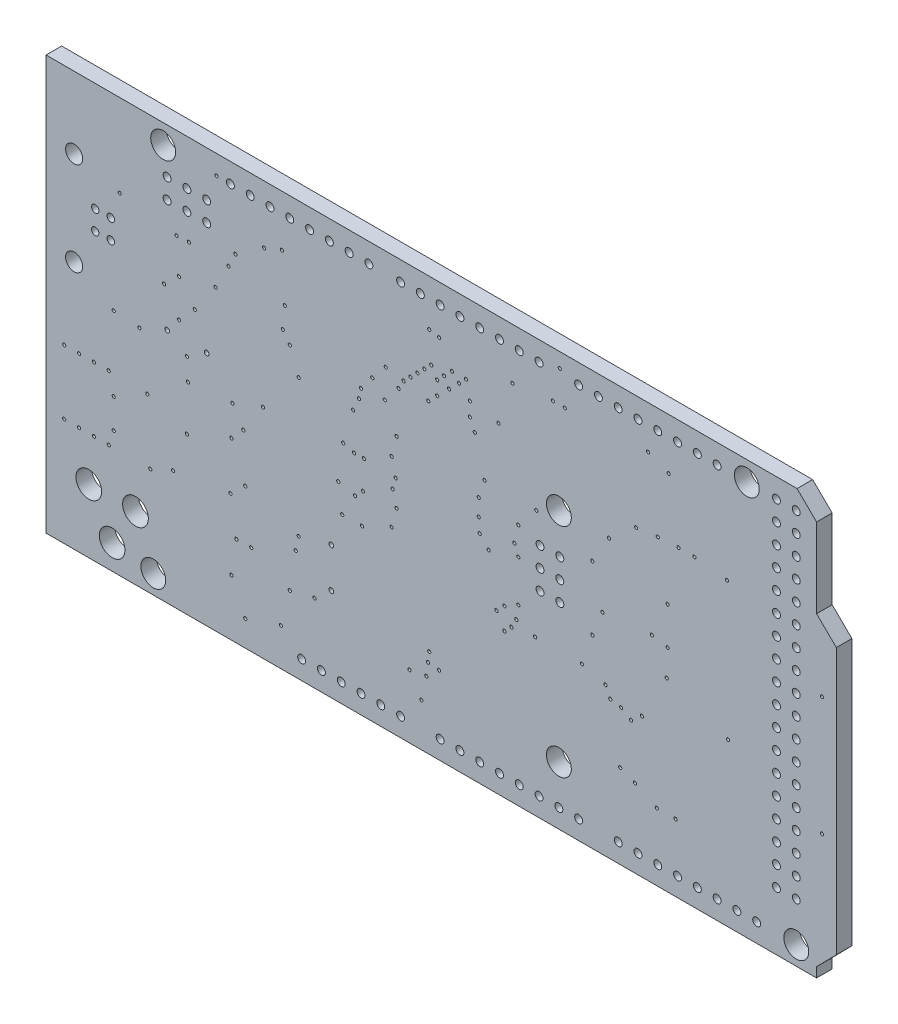
from build123d import *

# Parameters (mm, degrees)
SKETCH1_W           = 134.5210924
SKETCH1_H           = 72.181339
SKETCH1_R           = 1.5999968
SKETCH1_R_2         = 0.508
SKETCH1_R_3         = 0.3048
SKETCH1_R_4         = 1.651
SKETCH1_R_5         = 0.4750054
SKETCH1_R_6         = 1.0999978
SKETCH1_R_7         = 0.2032
BOSS_EXTRUDE1_DEPTH = 2
SKETCH2_W           = 162.13268737
SKETCH2_H           = 90.144306229
CUT_EXTRUDE1_DEPTH  = 10


with BuildPart() as part:
    # Sketch1 → Boss-Extrude1 (new body)
    with BuildSketch(Plane(origin=(0, 0, 0), x_dir=(-1, 0, 0), z_dir=(0, 0, -1))):
        with Locations((-40.0783056, -28.4573305)):
            Rectangle(SKETCH1_W, SKETCH1_H)
        with Locations(Location((-81.88, -46.26, 0), (0, 0, 180))):
            Circle(SKETCH1_R, mode=Mode.SUBTRACT)
        with Locations(Location((-0.6, 2, 0), (0, 0, 180))):
            Circle(SKETCH1_R, mode=Mode.SUBTRACT)
        with Locations(Location((-75.53, 2, 0), (0, 0, 180))):
            Circle(SKETCH1_R, mode=Mode.SUBTRACT)
        with Locations(Location((0.67, -46.26, 0), (0, 0, 180))):
            Circle(SKETCH1_R, mode=Mode.SUBTRACT)
        with Locations(Location((-51.4, -13.24, 0), (0, 0, 180))):
            Circle(SKETCH1_R, mode=Mode.SUBTRACT)
        with Locations(Location((-51.4, -41.18, 0), (0, 0, 180))):
            Circle(SKETCH1_R, mode=Mode.SUBTRACT)
        with Locations(Location((-59.02, -46.26, 0), (0, 0, 180))):
            Circle(SKETCH1_R_2, mode=Mode.SUBTRACT)
        with Locations(Location((-61.56, -46.26, 0), (0, 0, 180))):
            Circle(SKETCH1_R_2, mode=Mode.SUBTRACT)
        with Locations(Location((-64.1, -46.26, 0), (0, 0, 180))):
            Circle(SKETCH1_R_2, mode=Mode.SUBTRACT)
        with Locations(Location((-66.64, -46.26, 0), (0, 0, 180))):
            Circle(SKETCH1_R_2, mode=Mode.SUBTRACT)
        with Locations(Location((-69.18, -46.26, 0), (0, 0, 180))):
            Circle(SKETCH1_R_2, mode=Mode.SUBTRACT)
        with Locations(Location((-71.72, -46.26, 0), (0, 0, 180))):
            Circle(SKETCH1_R_2, mode=Mode.SUBTRACT)
        with Locations(Location((-74.26, -46.26, 0), (0, 0, 180))):
            Circle(SKETCH1_R_2, mode=Mode.SUBTRACT)
        with Locations(Location((-76.8, -46.26, 0), (0, 0, 180))):
            Circle(SKETCH1_R_2, mode=Mode.SUBTRACT)
        with Locations(Location((-36.16, -46.26, 0), (0, 0, 180))):
            Circle(SKETCH1_R_2, mode=Mode.SUBTRACT)
        with Locations(Location((-38.7, -46.26, 0), (0, 0, 180))):
            Circle(SKETCH1_R_2, mode=Mode.SUBTRACT)
        with Locations(Location((-41.24, -46.26, 0), (0, 0, 180))):
            Circle(SKETCH1_R_2, mode=Mode.SUBTRACT)
        with Locations(Location((-43.78, -46.26, 0), (0, 0, 180))):
            Circle(SKETCH1_R_2, mode=Mode.SUBTRACT)
        with Locations(Location((-46.32, -46.26, 0), (0, 0, 180))):
            Circle(SKETCH1_R_2, mode=Mode.SUBTRACT)
        with Locations(Location((-48.86, -46.26, 0), (0, 0, 180))):
            Circle(SKETCH1_R_2, mode=Mode.SUBTRACT)
        with Locations(Location((-51.4, -46.26, 0), (0, 0, 180))):
            Circle(SKETCH1_R_2, mode=Mode.SUBTRACT)
        with Locations(Location((-53.94, -46.26, 0), (0, 0, 180))):
            Circle(SKETCH1_R_2, mode=Mode.SUBTRACT)
        with Locations(Location((-71.72, 2, 0), (0, 0, 180))):
            Circle(SKETCH1_R_2, mode=Mode.SUBTRACT)
        with Locations(Location((-69.18, 2, 0), (0, 0, 180))):
            Circle(SKETCH1_R_2, mode=Mode.SUBTRACT)
        with Locations(Location((-66.64, 2, 0), (0, 0, 180))):
            Circle(SKETCH1_R_2, mode=Mode.SUBTRACT)
        with Locations(Location((-64.1, 2, 0), (0, 0, 180))):
            Circle(SKETCH1_R_2, mode=Mode.SUBTRACT)
        with Locations(Location((-61.56, 2, 0), (0, 0, 180))):
            Circle(SKETCH1_R_2, mode=Mode.SUBTRACT)
        with Locations(Location((-59.02, 2, 0), (0, 0, 180))):
            Circle(SKETCH1_R_2, mode=Mode.SUBTRACT)
        with Locations(Location((-56.48, 2, 0), (0, 0, 180))):
            Circle(SKETCH1_R_2, mode=Mode.SUBTRACT)
        with Locations(Location((-53.94, 2, 0), (0, 0, 180))):
            Circle(SKETCH1_R_2, mode=Mode.SUBTRACT)
        with Locations(Location((-48.987, -18.32, 0), (0, 0, 180))):
            Circle(SKETCH1_R_2, mode=Mode.SUBTRACT)
        with Locations(Location((-51.527, -18.32, 0), (0, 0, 180))):
            Circle(SKETCH1_R_2, mode=Mode.SUBTRACT)
        with Locations(Location((-48.987, -20.86, 0), (0, 0, 180))):
            Circle(SKETCH1_R_2, mode=Mode.SUBTRACT)
        with Locations(Location((-51.527, -20.86, 0), (0, 0, 180))):
            Circle(SKETCH1_R_2, mode=Mode.SUBTRACT)
        with Locations(Location((-48.987, -23.4, 0), (0, 0, 180))):
            Circle(SKETCH1_R_2, mode=Mode.SUBTRACT)
        with Locations(Location((-51.527, -23.4, 0), (0, 0, 180))):
            Circle(SKETCH1_R_2, mode=Mode.SUBTRACT)
        with Locations(Location((-6.188, -1.302, 0), (0, 0, 180))):
            Circle(SKETCH1_R_2, mode=Mode.SUBTRACT)
        with Locations(Location((-6.188, -3.842, 0), (0, 0, 180))):
            Circle(SKETCH1_R_2, mode=Mode.SUBTRACT)
        with Locations(Location((-3.648, -1.302, 0), (0, 0, 180))):
            Circle(SKETCH1_R_2, mode=Mode.SUBTRACT)
        with Locations(Location((-3.648, -3.842, 0), (0, 0, 180))):
            Circle(SKETCH1_R_2, mode=Mode.SUBTRACT)
        with Locations(Location((-1.108, -1.302, 0), (0, 0, 180))):
            Circle(SKETCH1_R_2, mode=Mode.SUBTRACT)
        with Locations(Location((-1.108, -3.842, 0), (0, 0, 180))):
            Circle(SKETCH1_R_2, mode=Mode.SUBTRACT)
        with Locations(Location((-79.34, 2, 0), (0, 0, 180))):
            Circle(SKETCH1_R_2, mode=Mode.SUBTRACT)
        with Locations(Location((-81.88, 2, 0), (0, 0, 180))):
            Circle(SKETCH1_R_2, mode=Mode.SUBTRACT)
        with Locations(Location((-79.34, -41.18, 0), (0, 0, 180))):
            Circle(SKETCH1_R_2, mode=Mode.SUBTRACT)
        with Locations(Location((-81.88, -41.18, 0), (0, 0, 180))):
            Circle(SKETCH1_R_2, mode=Mode.SUBTRACT)
        with Locations(Location((-18.38, -46.26, 0), (0, 0, 180))):
            Circle(SKETCH1_R_2, mode=Mode.SUBTRACT)
        with Locations(Location((-20.92, -46.26, 0), (0, 0, 180))):
            Circle(SKETCH1_R_2, mode=Mode.SUBTRACT)
        with Locations(Location((-23.46, -46.26, 0), (0, 0, 180))):
            Circle(SKETCH1_R_2, mode=Mode.SUBTRACT)
        with Locations(Location((-26, -46.26, 0), (0, 0, 180))):
            Circle(SKETCH1_R_2, mode=Mode.SUBTRACT)
        with Locations(Location((-28.54, -46.26, 0), (0, 0, 180))):
            Circle(SKETCH1_R_2, mode=Mode.SUBTRACT)
        with Locations(Location((-31.08, -46.26, 0), (0, 0, 180))):
            Circle(SKETCH1_R_2, mode=Mode.SUBTRACT)
        with Locations(Location((-27.016, 2, 0), (0, 0, 180))):
            Circle(SKETCH1_R_2, mode=Mode.SUBTRACT)
        with Locations(Location((-24.476, 2, 0), (0, 0, 180))):
            Circle(SKETCH1_R_2, mode=Mode.SUBTRACT)
        with Locations(Location((-21.936, 2, 0), (0, 0, 180))):
            Circle(SKETCH1_R_2, mode=Mode.SUBTRACT)
        with Locations(Location((-19.396, 2, 0), (0, 0, 180))):
            Circle(SKETCH1_R_2, mode=Mode.SUBTRACT)
        with Locations(Location((-16.856, 2, 0), (0, 0, 180))):
            Circle(SKETCH1_R_2, mode=Mode.SUBTRACT)
        with Locations(Location((-14.316, 2, 0), (0, 0, 180))):
            Circle(SKETCH1_R_2, mode=Mode.SUBTRACT)
        with Locations(Location((-11.776, 2, 0), (0, 0, 180))):
            Circle(SKETCH1_R_2, mode=Mode.SUBTRACT)
        with Locations(Location((-9.236, 2, 0), (0, 0, 180))):
            Circle(SKETCH1_R_2, mode=Mode.SUBTRACT)
        with Locations(Location((-48.86, 2, 0), (0, 0, 180))):
            Circle(SKETCH1_R_2, mode=Mode.SUBTRACT)
        with Locations(Location((-46.32, 2, 0), (0, 0, 180))):
            Circle(SKETCH1_R_2, mode=Mode.SUBTRACT)
        with Locations(Location((-43.78, 2, 0), (0, 0, 180))):
            Circle(SKETCH1_R_2, mode=Mode.SUBTRACT)
        with Locations(Location((-41.24, 2, 0), (0, 0, 180))):
            Circle(SKETCH1_R_2, mode=Mode.SUBTRACT)
        with Locations(Location((-38.7, 2, 0), (0, 0, 180))):
            Circle(SKETCH1_R_2, mode=Mode.SUBTRACT)
        with Locations(Location((-36.16, 2, 0), (0, 0, 180))):
            Circle(SKETCH1_R_2, mode=Mode.SUBTRACT)
        with Locations(Location((-33.62, 2, 0), (0, 0, 180))):
            Circle(SKETCH1_R_2, mode=Mode.SUBTRACT)
        with Locations(Location((-31.08, 2, 0), (0, 0, 180))):
            Circle(SKETCH1_R_2, mode=Mode.SUBTRACT)
        with Locations(Location((-6.188, -18.32, 0), (0, 0, 180))):
            Circle(SKETCH1_R_3, mode=Mode.SUBTRACT)
        with Locations(Location((-1.108, -18.32, 0), (0, 0, 180))):
            Circle(SKETCH1_R_3, mode=Mode.SUBTRACT)
        with Locations(Location((-22.19, -31.655, 0), (0, 0, 180))):
            Circle(SKETCH1_R_3, mode=Mode.SUBTRACT)
        with Locations(Location((-22.19, -36.735, 0), (0, 0, 180))):
            Circle(SKETCH1_R_3, mode=Mode.SUBTRACT)
        with Locations(Location((5.9532, -45.498, 0), (0, 0, 180))):
            Circle(SKETCH1_R_4, mode=Mode.SUBTRACT)
        with Locations(Location((2.956, -40.4942, 0), (0, 0, 180))):
            Circle(SKETCH1_R_4, mode=Mode.SUBTRACT)
        with Locations(Location((8.9504, -40.4942, 0), (0, 0, 180))):
            Circle(SKETCH1_R_4, mode=Mode.SUBTRACT)
        with Locations(Location((6.1200018, -11.9500102, 0), (0, 0, 180))):
            Circle(SKETCH1_R_5, mode=Mode.SUBTRACT)
        with Locations(Location((6.1200018, -9.4499898, 0), (0, 0, 180))):
            Circle(SKETCH1_R_5, mode=Mode.SUBTRACT)
        with Locations(Location((8.1199978, -9.4499898, 0), (0, 0, 180))):
            Circle(SKETCH1_R_5, mode=Mode.SUBTRACT)
        with Locations(Location((8.1199978, -11.9500102, 0), (0, 0, 180))):
            Circle(SKETCH1_R_5, mode=Mode.SUBTRACT)
        with Locations(Location((10.83, -4.700012, 0), (0, 0, 180))):
            Circle(SKETCH1_R_6, mode=Mode.SUBTRACT)
        with Locations(Location((10.83, -16.699988, 0), (0, 0, 180))):
            Circle(SKETCH1_R_6, mode=Mode.SUBTRACT)
        with Locations(Location((-81.88, -18.32, 0), (0, 0, 180))):
            Circle(SKETCH1_R_2, mode=Mode.SUBTRACT)
        with Locations(Location((-79.34, -18.32, 0), (0, 0, 180))):
            Circle(SKETCH1_R_2, mode=Mode.SUBTRACT)
        with Locations(Location((-81.88, -15.78, 0), (0, 0, 180))):
            Circle(SKETCH1_R_2, mode=Mode.SUBTRACT)
        with Locations(Location((-79.34, -15.78, 0), (0, 0, 180))):
            Circle(SKETCH1_R_2, mode=Mode.SUBTRACT)
        with Locations(Location((-81.88, -13.24, 0), (0, 0, 180))):
            Circle(SKETCH1_R_2, mode=Mode.SUBTRACT)
        with Locations(Location((-79.34, -13.24, 0), (0, 0, 180))):
            Circle(SKETCH1_R_2, mode=Mode.SUBTRACT)
        with Locations(Location((-81.88, -10.7, 0), (0, 0, 180))):
            Circle(SKETCH1_R_2, mode=Mode.SUBTRACT)
        with Locations(Location((-79.34, -10.7, 0), (0, 0, 180))):
            Circle(SKETCH1_R_2, mode=Mode.SUBTRACT)
        with Locations(Location((-81.88, -8.16, 0), (0, 0, 180))):
            Circle(SKETCH1_R_2, mode=Mode.SUBTRACT)
        with Locations(Location((-79.34, -8.16, 0), (0, 0, 180))):
            Circle(SKETCH1_R_2, mode=Mode.SUBTRACT)
        with Locations(Location((-81.88, -5.62, 0), (0, 0, 180))):
            Circle(SKETCH1_R_2, mode=Mode.SUBTRACT)
        with Locations(Location((-79.34, -5.62, 0), (0, 0, 180))):
            Circle(SKETCH1_R_2, mode=Mode.SUBTRACT)
        with Locations(Location((-81.88, -3.08, 0), (0, 0, 180))):
            Circle(SKETCH1_R_2, mode=Mode.SUBTRACT)
        with Locations(Location((-79.34, -3.08, 0), (0, 0, 180))):
            Circle(SKETCH1_R_2, mode=Mode.SUBTRACT)
        with Locations(Location((-81.88, -0.54, 0), (0, 0, 180))):
            Circle(SKETCH1_R_2, mode=Mode.SUBTRACT)
        with Locations(Location((-79.34, -0.54, 0), (0, 0, 180))):
            Circle(SKETCH1_R_2, mode=Mode.SUBTRACT)
        with Locations(Location((-81.88, -38.64, 0), (0, 0, 180))):
            Circle(SKETCH1_R_2, mode=Mode.SUBTRACT)
        with Locations(Location((-79.34, -38.64, 0), (0, 0, 180))):
            Circle(SKETCH1_R_2, mode=Mode.SUBTRACT)
        with Locations(Location((-81.88, -36.1, 0), (0, 0, 180))):
            Circle(SKETCH1_R_2, mode=Mode.SUBTRACT)
        with Locations(Location((-79.34, -36.1, 0), (0, 0, 180))):
            Circle(SKETCH1_R_2, mode=Mode.SUBTRACT)
        with Locations(Location((-81.88, -33.56, 0), (0, 0, 180))):
            Circle(SKETCH1_R_2, mode=Mode.SUBTRACT)
        with Locations(Location((-79.34, -33.56, 0), (0, 0, 180))):
            Circle(SKETCH1_R_2, mode=Mode.SUBTRACT)
        with Locations(Location((-81.88, -31.02, 0), (0, 0, 180))):
            Circle(SKETCH1_R_2, mode=Mode.SUBTRACT)
        with Locations(Location((-79.34, -31.02, 0), (0, 0, 180))):
            Circle(SKETCH1_R_2, mode=Mode.SUBTRACT)
        with Locations(Location((-81.88, -28.48, 0), (0, 0, 180))):
            Circle(SKETCH1_R_2, mode=Mode.SUBTRACT)
        with Locations(Location((-79.34, -28.48, 0), (0, 0, 180))):
            Circle(SKETCH1_R_2, mode=Mode.SUBTRACT)
        with Locations(Location((-81.88, -25.94, 0), (0, 0, 180))):
            Circle(SKETCH1_R_2, mode=Mode.SUBTRACT)
        with Locations(Location((-79.34, -25.94, 0), (0, 0, 180))):
            Circle(SKETCH1_R_2, mode=Mode.SUBTRACT)
        with Locations(Location((-81.88, -23.4, 0), (0, 0, 180))):
            Circle(SKETCH1_R_2, mode=Mode.SUBTRACT)
        with Locations(Location((-79.34, -23.4, 0), (0, 0, 180))):
            Circle(SKETCH1_R_2, mode=Mode.SUBTRACT)
        with Locations(Location((-81.88, -20.86, 0), (0, 0, 180))):
            Circle(SKETCH1_R_2, mode=Mode.SUBTRACT)
        with Locations(Location((-79.34, -20.86, 0), (0, 0, 180))):
            Circle(SKETCH1_R_2, mode=Mode.SUBTRACT)
        with Locations(Location((-20.031, -38.64, 0), (0, 0, 180))):
            Circle(SKETCH1_R_7, mode=Mode.SUBTRACT)
        with Locations(Location((-9.363, -26.194, 0), (0, 0, 180))):
            Circle(SKETCH1_R_7, mode=Mode.SUBTRACT)
        with Locations(Location((-15.713, -43.847, 0), (0, 0, 180))):
            Circle(SKETCH1_R_7, mode=Mode.SUBTRACT)
        with Locations(Location((-17.618, -34.576, 0), (0, 0, 180))):
            Circle(SKETCH1_R_7, mode=Mode.SUBTRACT)
        with Locations(Location((-68.799, -9.684, 0), (0, 0, 180))):
            Circle(SKETCH1_R_7, mode=Mode.SUBTRACT)
        with Locations(Location((-41.8496, -14.637, 0), (0, 0, 180))):
            Circle(SKETCH1_R_7, mode=Mode.SUBTRACT)
        with Locations(Location((-48.5044, -14.6624, 0), (0, 0, 180))):
            Circle(SKETCH1_R_7, mode=Mode.SUBTRACT)
        with Locations(Location((-42.383, -22.13, 0), (0, 0, 180))):
            Circle(SKETCH1_R_7, mode=Mode.SUBTRACT)
        with Locations(Location((-29.937, -17.939, 0), (0, 0, 180))):
            Circle(SKETCH1_R_7, mode=Mode.SUBTRACT)
        with Locations(Location((-29.048, -12.097, 0), (0, 0, 180))):
            Circle(SKETCH1_R_7, mode=Mode.SUBTRACT)
        with Locations(Location((8.29, -26.575, 0), (0, 0, 180))):
            Circle(SKETCH1_R_7, mode=Mode.SUBTRACT)
        with Locations(Location((5.75, -19.59, 0), (0, 0, 180))):
            Circle(SKETCH1_R_7, mode=Mode.SUBTRACT)
        with Locations(Location((10.195, -26.575, 0), (0, 0, 180))):
            Circle(SKETCH1_R_7, mode=Mode.SUBTRACT)
        with Locations(Location((6.385, -26.575, 0), (0, 0, 180))):
            Circle(SKETCH1_R_7, mode=Mode.SUBTRACT)
        with Locations(Location((12.1, -26.575, 0), (0, 0, 180))):
            Circle(SKETCH1_R_7, mode=Mode.SUBTRACT)
        with Locations(Location((5.75, -29.115, 0), (0, 0, 180))):
            Circle(SKETCH1_R_7, mode=Mode.SUBTRACT)
        with Locations(Location((12.1, -34.83, 0), (0, 0, 180))):
            Circle(SKETCH1_R_7, mode=Mode.SUBTRACT)
        with Locations(Location((8.29, -34.83, 0), (0, 0, 180))):
            Circle(SKETCH1_R_7, mode=Mode.SUBTRACT)
        with Locations(Location((10.195, -34.83, 0), (0, 0, 180))):
            Circle(SKETCH1_R_7, mode=Mode.SUBTRACT)
        with Locations(Location((5.75, -32.925, 0), (0, 0, 180))):
            Circle(SKETCH1_R_7, mode=Mode.SUBTRACT)
        with Locations(Location((6.385, -34.83, 0), (0, 0, 180))):
            Circle(SKETCH1_R_7, mode=Mode.SUBTRACT)
        with Locations(Location((-0.727, -13.367, 0), (0, 0, 180))):
            Circle(SKETCH1_R_7, mode=Mode.SUBTRACT)
        with Locations(Location((-4.664, -14.256, 0), (0, 0, 180))):
            Circle(SKETCH1_R_7, mode=Mode.SUBTRACT)
        with Locations(Location((-13.427, -20.733, 0), (0, 0, 180))):
            Circle(SKETCH1_R_7, mode=Mode.SUBTRACT)
        with Locations(Location((-8.982, -7.271, 0), (0, 0, 180))):
            Circle(SKETCH1_R_7, mode=Mode.SUBTRACT)
        with Locations(Location((-9.236, -32.417, 0), (0, 0, 180))):
            Circle(SKETCH1_R_7, mode=Mode.SUBTRACT)
        with Locations(Location((-30.826, -9.938, 0), (0, 0, 180))):
            Circle(SKETCH1_R_7, mode=Mode.SUBTRACT)
        with Locations(Location((-31.461, -8.795, 0), (0, 0, 180))):
            Circle(SKETCH1_R_7, mode=Mode.SUBTRACT)
        with Locations(Location((-32.35, -7.906, 0), (0, 0, 180))):
            Circle(SKETCH1_R_7, mode=Mode.SUBTRACT)
        with Locations(Location((-33.239, -7.017, 0), (0, 0, 180))):
            Circle(SKETCH1_R_7, mode=Mode.SUBTRACT)
        with Locations(Location((-34.128, -6.128, 0), (0, 0, 180))):
            Circle(SKETCH1_R_7, mode=Mode.SUBTRACT)
        with Locations(Location((-35.017, -5.239, 0), (0, 0, 180))):
            Circle(SKETCH1_R_7, mode=Mode.SUBTRACT)
        with Locations(Location((-34.636, -9.43, 0), (0, 0, 180))):
            Circle(SKETCH1_R_7, mode=Mode.SUBTRACT)
        with Locations(Location((-35.779, -6.509, 0), (0, 0, 180))):
            Circle(SKETCH1_R_7, mode=Mode.SUBTRACT)
        with Locations(Location((-35.779, -8.287, 0), (0, 0, 180))):
            Circle(SKETCH1_R_7, mode=Mode.SUBTRACT)
        with Locations(Location((-36.668, -5.62, 0), (0, 0, 180))):
            Circle(SKETCH1_R_7, mode=Mode.SUBTRACT)
        with Locations(Location((-37.303, -6.763, 0), (0, 0, 180))):
            Circle(SKETCH1_R_7, mode=Mode.SUBTRACT)
        with Locations(Location((-37.684, -4.604, 0), (0, 0, 180))):
            Circle(SKETCH1_R_7, mode=Mode.SUBTRACT)
        with Locations(Location((-38.573, -5.493, 0), (0, 0, 180))):
            Circle(SKETCH1_R_7, mode=Mode.SUBTRACT)
        with Locations(Location((-39.462, -4.604, 0), (0, 0, 180))):
            Circle(SKETCH1_R_7, mode=Mode.SUBTRACT)
        with Locations(Location((-39.97, -6.763, 0), (0, 0, 180))):
            Circle(SKETCH1_R_7, mode=Mode.SUBTRACT)
        with Locations(Location((-39.97, -8.541, 0), (0, 0, 180))):
            Circle(SKETCH1_R_7, mode=Mode.SUBTRACT)
        with Locations(Location((-27.4478, -10.446, 0), (0, 0, 180))):
            Circle(SKETCH1_R_7, mode=Mode.SUBTRACT)
        with Locations(Location((-13.554, -2.953, 0), (0, 0, 180))):
            Circle(SKETCH1_R_7, mode=Mode.SUBTRACT)
        with Locations(Location((-11.141, -30.639, 0), (0, 0, 180))):
            Circle(SKETCH1_R_7, mode=Mode.SUBTRACT)
        with Locations(Location((-7.331, -10.446, 0), (0, 0, 180))):
            Circle(SKETCH1_R_7, mode=Mode.SUBTRACT)
        with Locations(Location((-3.775, -22.765, 0), (0, 0, 180))):
            Circle(SKETCH1_R_7, mode=Mode.SUBTRACT)
        with Locations(Location((-41.24, -20.86, 0), (0, 0, 180))):
            Circle(SKETCH1_R_7, mode=Mode.SUBTRACT)
        with Locations(Location((-46.193, -17.431, 0), (0, 0, 180))):
            Circle(SKETCH1_R_7, mode=Mode.SUBTRACT)
        with Locations(Location((-54.359989, -28.7999892, 0), (0, 0, 180))):
            Circle(SKETCH1_R_7, mode=Mode.SUBTRACT)
        with Locations(Location((-23.587, -27.591, 0), (0, 0, 180))):
            Circle(SKETCH1_R_7, mode=Mode.SUBTRACT)
        with Locations(Location((-30.445, -20.098, 0), (0, 0, 180))):
            Circle(SKETCH1_R_7, mode=Mode.SUBTRACT)
        with Locations(Location((-30.572, -15.399, 0), (0, 0, 180))):
            Circle(SKETCH1_R_7, mode=Mode.SUBTRACT)
        with Locations(Location((-40.605, -9.938, 0), (0, 0, 180))):
            Circle(SKETCH1_R_7, mode=Mode.SUBTRACT)
        with Locations(Location((-17.999, -15.145, 0), (0, 0, 180))):
            Circle(SKETCH1_R_7, mode=Mode.SUBTRACT)
        with Locations(Location((-23.714, -19.573998, 0), (0, 0, 180))):
            Circle(SKETCH1_R_7, mode=Mode.SUBTRACT)
        with Locations(Location((-72.99, -10.192, 0), (0, 0, 180))):
            Circle(SKETCH1_R_7, mode=Mode.SUBTRACT)
        with Locations(Location((-73.117, -27.845, 0), (0, 0, 180))):
            Circle(SKETCH1_R_7, mode=Mode.SUBTRACT)
        with Locations(Location((-57.8516, -13.0876, 0), (0, 0, 180))):
            Circle(SKETCH1_R_7, mode=Mode.SUBTRACT)
        with Locations(Location((-9.998, -37.116, 0), (0, 0, 180))):
            Circle(SKETCH1_R_7, mode=Mode.SUBTRACT)
        with Locations(Location((1.051, -34.83, 0), (0, 0, 180))):
            Circle(SKETCH1_R_7, mode=Mode.SUBTRACT)
        with Locations(Location((-17.999, -32.798, 0), (0, 0, 180))):
            Circle(SKETCH1_R_7, mode=Mode.SUBTRACT)
        with Locations(Location((-26.127, -27.591, 0), (0, 0, 180))):
            Circle(SKETCH1_R_7, mode=Mode.SUBTRACT)
        with Locations(Location((-2.632, -11.589, 0), (0, 0, 180))):
            Circle(SKETCH1_R_7, mode=Mode.SUBTRACT)
        with Locations(Location((-3.902, -7.144, 0), (0, 0, 180))):
            Circle(SKETCH1_R_7, mode=Mode.SUBTRACT)
        with Locations(Location((-10.887, -24.543, 0), (0, 0, 180))):
            Circle(SKETCH1_R_7, mode=Mode.SUBTRACT)
        with Locations(Location((-43.653, -7.398, 0), (0, 0, 180))):
            Circle(SKETCH1_R_7, mode=Mode.SUBTRACT)
        with Locations(Location((-62.8554, -0.9972, 0), (0, 0, 180))):
            Circle(SKETCH1_R_7, mode=Mode.SUBTRACT)
        with Locations(Location((-29.175, -8.414, 0), (0, 0, 180))):
            Circle(SKETCH1_R_7, mode=Mode.SUBTRACT)
        with Locations(Location((-30.064, -21.495, 0), (0, 0, 180))):
            Circle(SKETCH1_R_7, mode=Mode.SUBTRACT)
        with Locations(Location((-33.747, -43.133006, 0), (0, 0, 180))):
            Circle(SKETCH1_R_7, mode=Mode.SUBTRACT)
        with Locations(Location((-11.141, -45.371, 0), (0, 0, 180))):
            Circle(SKETCH1_R_7, mode=Mode.SUBTRACT)
        with Locations(Location((1.432, -26.702, 0), (0, 0, 180))):
            Circle(SKETCH1_R_7, mode=Mode.SUBTRACT)
        with Locations(Location((-9.49, -22.257, 0), (0, 0, 180))):
            Circle(SKETCH1_R_7, mode=Mode.SUBTRACT)
        with Locations(Location((-9.871, -5.493, 0), (0, 0, 180))):
            Circle(SKETCH1_R_7, mode=Mode.SUBTRACT)
        with Locations(Location((-46.193, -20.987, 0), (0, 0, 180))):
            Circle(SKETCH1_R_7, mode=Mode.SUBTRACT)
        with Locations(Location((-43.399, -28.353, 0), (0, 0, 180))):
            Circle(SKETCH1_R_7, mode=Mode.SUBTRACT)
        with Locations(Location((2.448, -19.844, 0), (0, 0, 180))):
            Circle(SKETCH1_R_7, mode=Mode.SUBTRACT)
        with Locations(Location((-23.079, -24.162, 0), (0, 0, 180))):
            Circle(SKETCH1_R_7, mode=Mode.SUBTRACT)
        with Locations(Location((-63.338, -21.114, 0), (0, 0, 180))):
            Circle(SKETCH1_R_7, mode=Mode.SUBTRACT)
        with Locations(Location((-62.068, -30.757999, 0), (0, 0, 180))):
            Circle(SKETCH1_R_7, mode=Mode.SUBTRACT)
        with Locations(Location((-85.165998, -17.05, 0), (0, 0, 180))):
            Circle(SKETCH1_R_7, mode=Mode.SUBTRACT)
        with Locations(Location((-65.243, -24.924, 0), (0, 0, 180))):
            Circle(SKETCH1_R_7, mode=Mode.SUBTRACT)
        with Locations(Location((-55.718, -24.924, 0), (0, 0, 180))):
            Circle(SKETCH1_R_7, mode=Mode.SUBTRACT)
        with Locations(Location((-56.988, -21.749, 0), (0, 0, 180))):
            Circle(SKETCH1_R_7, mode=Mode.SUBTRACT)
        with Locations(Location((-3.648, -19.971, 0), (0, 0, 180))):
            Circle(SKETCH1_R_7, mode=Mode.SUBTRACT)
        with Locations(Location((-55.7015916, -16.7026042, 0), (0, 0, 180))):
            Circle(SKETCH1_R_7, mode=Mode.SUBTRACT)
        with Locations(Location((-48.360001, -28.7999892, 0), (0, 0, 180))):
            Circle(SKETCH1_R_7, mode=Mode.SUBTRACT)
        with Locations(Location((-2.632, -16.415, 0), (0, 0, 180))):
            Circle(SKETCH1_R_7, mode=Mode.SUBTRACT)
        with Locations(Location((-85.165998, -32.29, 0), (0, 0, 180))):
            Circle(SKETCH1_R_7, mode=Mode.SUBTRACT)
        with Locations(Location((-51.510998, 2.635, 0), (0, 0, 180))):
            Circle(SKETCH1_R_7, mode=Mode.SUBTRACT)
        with Locations(Location((-7.441998, 2, 0), (0, 0, 180))):
            Circle(SKETCH1_R_7, mode=Mode.SUBTRACT)
        with Locations(Location((-3.648, -28.607, 0), (0, 0, 180))):
            Circle(SKETCH1_R_7, mode=Mode.SUBTRACT)
        with Locations(Location((-61.322002, -10.175998, 0), (0, 0, 180))):
            Circle(SKETCH1_R_7, mode=Mode.SUBTRACT)
        with Locations(Location((-65.497, -2.064, 0), (0, 0, 180))):
            Circle(SKETCH1_R_7, mode=Mode.SUBTRACT)
        with Locations(Location((-45.431, -2.064, 0), (0, 0, 180))):
            Circle(SKETCH1_R_7, mode=Mode.SUBTRACT)
        with Locations(Location((-15.84, -2.064, 0), (0, 0, 180))):
            Circle(SKETCH1_R_7, mode=Mode.SUBTRACT)
        with Locations(Location((-30.572, -23.4, 0), (0, 0, 180))):
            Circle(SKETCH1_R_7, mode=Mode.SUBTRACT)
        with Locations(Location((-34.763, -37.243, 0), (0, 0, 180))):
            Circle(SKETCH1_R_7, mode=Mode.SUBTRACT)
        with Locations(Location((-59.274, -37.878, 0), (0, 0, 180))):
            Circle(SKETCH1_R_7, mode=Mode.SUBTRACT)
        with Locations(Location((-26.254, -23.654, 0), (0, 0, 180))):
            Circle(SKETCH1_R_7, mode=Mode.SUBTRACT)
        with Locations(Location((-34.5900006, -38.513, 0), (0, 0, 180))):
            Circle(SKETCH1_R_7, mode=Mode.SUBTRACT)
        with Locations(Location((-25.238, -24.67, 0), (0, 0, 180))):
            Circle(SKETCH1_R_7, mode=Mode.SUBTRACT)
        with Locations(Location((-36.033, -38.6750012, 0), (0, 0, 180))):
            Circle(SKETCH1_R_7, mode=Mode.SUBTRACT)
        with Locations(Location((-61.179, -38.64, 0), (0, 0, 180))):
            Circle(SKETCH1_R_7, mode=Mode.SUBTRACT)
        with Locations(Location((-29.937, -25.813, 0), (0, 0, 180))):
            Circle(SKETCH1_R_7, mode=Mode.SUBTRACT)
        with Locations(Location((-34.382, -40.164, 0), (0, 0, 180))):
            Circle(SKETCH1_R_7, mode=Mode.SUBTRACT)
        with Locations(Location((-66.386, -40.037, 0), (0, 0, 180))):
            Circle(SKETCH1_R_7, mode=Mode.SUBTRACT)
        with Locations(Location((-16.221, -8.033, 0), (0, 0, 180))):
            Circle(SKETCH1_R_7, mode=Mode.SUBTRACT)
        with Locations(Location((-15.967, -10.827, 0), (0, 0, 180))):
            Circle(SKETCH1_R_7, mode=Mode.SUBTRACT)
        with Locations(Location((-26, -12.351, 0), (0, 0, 180))):
            Circle(SKETCH1_R_7, mode=Mode.SUBTRACT)
        with Locations(Location((-25.746, -13.621, 0), (0, 0, 180))):
            Circle(SKETCH1_R_7, mode=Mode.SUBTRACT)
        with Locations(Location((-24.984, -15.272, 0), (0, 0, 180))):
            Circle(SKETCH1_R_7, mode=Mode.SUBTRACT)
        with Locations(Location((-16.856, -12.097, 0), (0, 0, 180))):
            Circle(SKETCH1_R_7, mode=Mode.SUBTRACT)
        with Locations(Location((-34.763, -1.429, 0), (0, 0, 180))):
            Circle(SKETCH1_R_7, mode=Mode.SUBTRACT)
        with Locations(Location((-44.415, -27.337, 0), (0, 0, 180))):
            Circle(SKETCH1_R_7, mode=Mode.SUBTRACT)
        with Locations(Location((-44.415, -30.131, 0), (0, 0, 180))):
            Circle(SKETCH1_R_7, mode=Mode.SUBTRACT)
        with Locations(Location((-46.193, -26.321, 0), (0, 0, 180))):
            Circle(SKETCH1_R_7, mode=Mode.SUBTRACT)
        with Locations(Location((-45.304, -29.242, 0), (0, 0, 180))):
            Circle(SKETCH1_R_7, mode=Mode.SUBTRACT)
        with Locations(Location((-45.939, -28.099, 0), (0, 0, 180))):
            Circle(SKETCH1_R_7, mode=Mode.SUBTRACT)
        with Locations(Location((-45.685, -19.717, 0), (0, 0, 180))):
            Circle(SKETCH1_R_7, mode=Mode.SUBTRACT)
        with Locations(Location((-36.033, -1.683, 0), (0, 0, 180))):
            Circle(SKETCH1_R_7, mode=Mode.SUBTRACT)
        with Locations(Location((-11.903, -37.116, 0), (0, 0, 180))):
            Circle(SKETCH1_R_7, mode=Mode.SUBTRACT)
        with Locations(Location((-63.973, -40.037, 0), (0, 0, 180))):
            Circle(SKETCH1_R_7, mode=Mode.SUBTRACT)
        with Locations(Location((-32.214999, -40.536999, 0), (0, 0, 180))):
            Circle(SKETCH1_R_7, mode=Mode.SUBTRACT)
        with Locations(Location((-16.856, -39.402, 0), (0, 0, 180))):
            Circle(SKETCH1_R_7, mode=Mode.SUBTRACT)
        with Locations(Location((-65.37, -21.495, 0), (0, 0, 180))):
            Circle(SKETCH1_R_7, mode=Mode.SUBTRACT)
        with Locations(Location((-65.37, -16.669, 0), (0, 0, 180))):
            Circle(SKETCH1_R_7, mode=Mode.SUBTRACT)
        with Locations(Location((-2.3145, -7.2075, 0), (0, 0, 180))):
            Circle(SKETCH1_R_7, mode=Mode.SUBTRACT)
        with Locations(Location((-1.87, -33.56, 0), (0, 0, 180))):
            Circle(SKETCH1_R_7, mode=Mode.SUBTRACT)
        with Locations(Location((-58.004, -30.893, 0), (0, 0, 180))):
            Circle(SKETCH1_R_7, mode=Mode.SUBTRACT)
        with Locations(Location((-26.381, -19.971, 0), (0, 0, 180))):
            Circle(SKETCH1_R_7, mode=Mode.SUBTRACT)
        with Locations(Location((-52.162, -1.429, 0), (0, 0, 180))):
            Circle(SKETCH1_R_7, mode=Mode.SUBTRACT)
        with Locations(Location((-41.113, -19.082, 0), (0, 0, 180))):
            Circle(SKETCH1_R_7, mode=Mode.SUBTRACT)
        with Locations(Location((-66.767, -9.684, 0), (0, 0, 180))):
            Circle(SKETCH1_R_7, mode=Mode.SUBTRACT)
        with Locations(Location((-60.671, -31.909, 0), (0, 0, 180))):
            Circle(SKETCH1_R_7, mode=Mode.SUBTRACT)
        with Locations(Location((-59.401, -31.147, 0), (0, 0, 180))):
            Circle(SKETCH1_R_7, mode=Mode.SUBTRACT)
        with Locations(Location((-64.1, -9.811, 0), (0, 0, 180))):
            Circle(SKETCH1_R_7, mode=Mode.SUBTRACT)
        with Locations(Location((-57.369, -29.623, 0), (0, 0, 180))):
            Circle(SKETCH1_R_7, mode=Mode.SUBTRACT)
        with Locations(Location((-25.111, -19.971, 0), (0, 0, 180))):
            Circle(SKETCH1_R_7, mode=Mode.SUBTRACT)
        with Locations(Location((-50.638, -1.429, 0), (0, 0, 180))):
            Circle(SKETCH1_R_7, mode=Mode.SUBTRACT)
        with Locations(Location((-41.113, -16.923, 0), (0, 0, 180))):
            Circle(SKETCH1_R_7, mode=Mode.SUBTRACT)
        with Locations(Location((4.988, -6.128, 0), (0, 0, 180))):
            Circle(SKETCH1_R_7, mode=Mode.SUBTRACT)
        with Locations(Location((-9.363, -41.434, 0), (0, 0, 180))):
            Circle(SKETCH1_R_7, mode=Mode.SUBTRACT)
    extrude(amount=-BOSS_EXTRUDE1_DEPTH)

    # Sketch2 → Cut-Extrude1 (cut)
    with BuildSketch(Plane.XY.offset(2)):
        with Locations((36.77751907, -24.452633364)):
            Rectangle(SKETCH2_W, SKETCH2_H)
        Polygon((-14.431067296, 4.498567891), (81.978998526, 4.498567891), (84.486391552, 2.039022194), (84.486391552, -8.164329625), (87.023949949, -10.653465062), (87.023949949, -44.819469807), (84.486391552, -47.40639317), (84.486391552, -48.666051309), (-14.431067296, -48.666051309), align=None, mode=Mode.SUBTRACT)
    extrude(amount=-CUT_EXTRUDE1_DEPTH, mode=Mode.SUBTRACT)


solid = part.part
